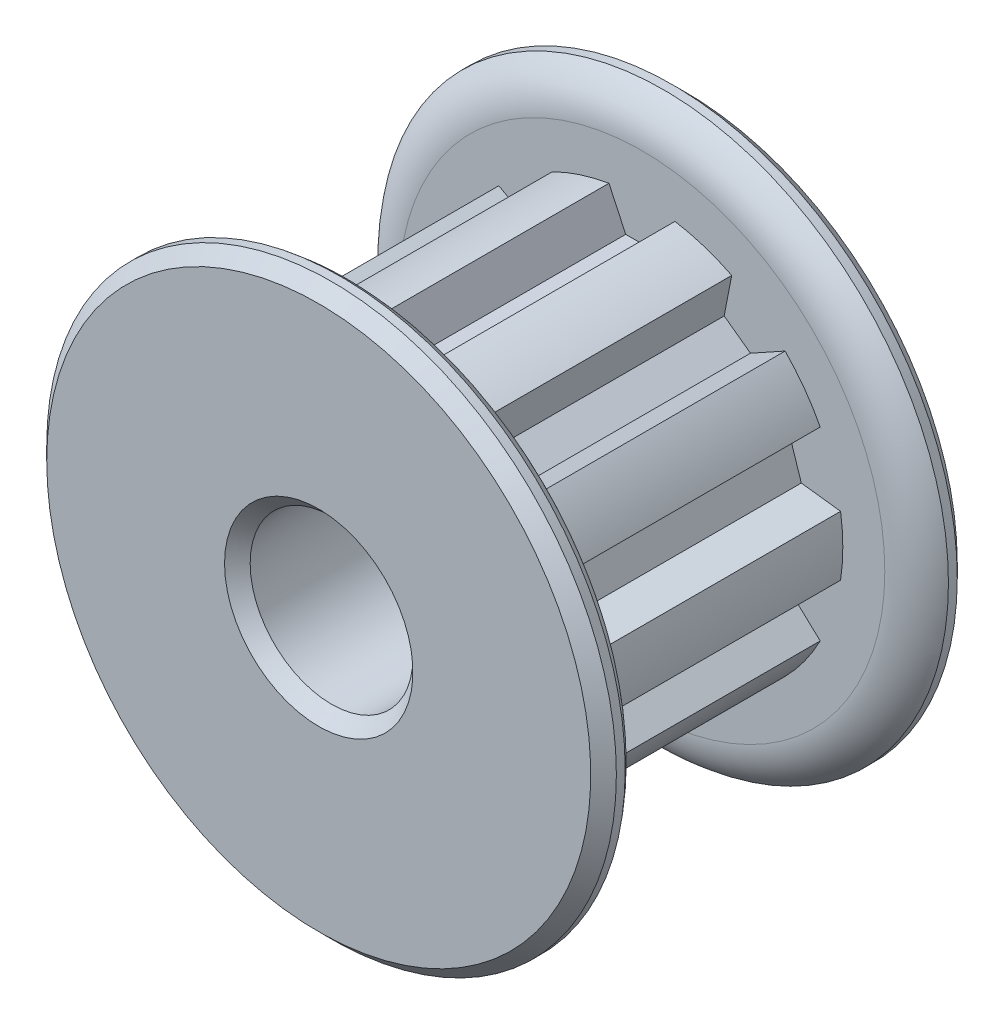
from build123d import *

# Parameters (mm, degrees)
CUT_EXTRUDE1_START = 2.2987
CUT_EXTRUDE1_DEPTH = 10.922
CIRPATTERN1_COUNT  = 10
CHAMFER1_SIZE      = 0.5


with BuildPart() as part:
    # Sketch2 → Revolve1 (revolve)
    with BuildSketch(Plane(origin=(0, 0, 0), x_dir=(0, 0, -1), z_dir=(1, 0, 0)), mode=Mode.PRIVATE) as revolve1_sk:
        with BuildLine():
            Line((-3.9878, 3.175), (10.3124, 3.175))
            Line((10.3124, 3.175), (10.3124, 11.1125))
            Line((10.3124, 11.1125), (9.46785, 11.1125))
            ThreePointArc((9.46785, 11.1125), (8.846862309, 10.395787163), (8.6233, 9.4742))
            Line((8.6233, 9.4742), (8.6233, 7.8359))
            Line((8.6233, 7.8359), (-2.2987, 7.8359))
            Line((-2.2987, 7.8359), (-2.2987, 9.4742))
            ThreePointArc((-2.2987, 9.4742), (-2.522262309, 10.395787163), (-3.14325, 11.1125))
            Line((-3.14325, 11.1125), (-3.9878, 11.1125))
            Line((-3.9878, 11.1125), (-3.9878, 3.175))
        make_face()
    revolve(revolve1_sk.sketch.rotate(Axis((0, 0, 10.3124), (0, 0, -1)), 90), axis=Axis((0, 0, 10.3124), (0, 0, -1)))

    # Sketch3 → Cut-Extrude1 (cut)
    with BuildSketch(Plane.XY.offset(CUT_EXTRUDE1_START)):
        with BuildLine():
            Line((-0.635, 6.329348022), (0.635, 6.329348022))
            Line((0.635, 6.329348022), (1.287830721, 7.729348022))
            ThreePointArc((1.287830721, 7.729348022), (0, 7.8359), (-1.287830721, 7.729348022))
            Line((-1.287830721, 7.729348022), (-0.635, 6.329348022))
        make_face()
    cut_extrude1 = extrude(amount=-CUT_EXTRUDE1_DEPTH, mode=Mode.SUBTRACT)

    # CirPattern1: Cut-Extrude1 ×10 about axis
    cirpattern1_axis = Axis((0, 0, 0), (0, 0, 1))
    for i in range(1, CIRPATTERN1_COUNT):
        add(cut_extrude1.rotate(cirpattern1_axis, i * 360 / CIRPATTERN1_COUNT), mode=Mode.SUBTRACT)

    # Chamfer1
    chamfer1_edges = [part.edges().sort_by_distance(p)[0] for p in [
        (-11.1125, 0, -10.3124),
        (-3.175, 0, -10.3124),
        (-3.175, 0, 3.9878),
        (-11.1125, 0, 3.9878),
    ]]
    chamfer(chamfer1_edges, length=CHAMFER1_SIZE)


solid = part.part
